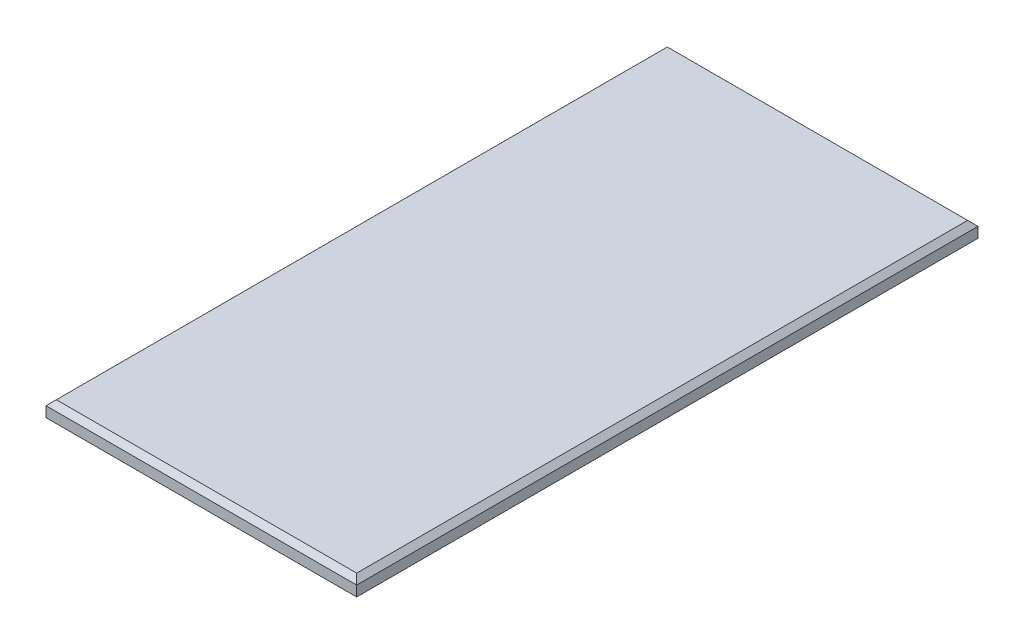
from build123d import *

# Parameters (mm, degrees)
SKETCH1_W           = 300
SKETCH1_H           = 600
BOSS_EXTRUDE1_DEPTH = 15
CHAMFER1_SIZE       = 5


with BuildPart() as part:
    # Sketch1 → Boss-Extrude1 (new body)
    with BuildSketch(Plane(origin=(0, 0, 0), x_dir=(1, 0, 0), z_dir=(0, 1, 0))):
        Rectangle(SKETCH1_W, SKETCH1_H)
    extrude(amount=BOSS_EXTRUDE1_DEPTH)

    # Chamfer1
    chamfer1_edges = [part.edges().sort_by_distance(p)[0] for p in [
        (0, 15, -300),
        (-150, 15, 0),
        (0, 15, 300),
        (150, 15, 0),
    ]]
    chamfer(chamfer1_edges, length=CHAMFER1_SIZE)


solid = part.part
